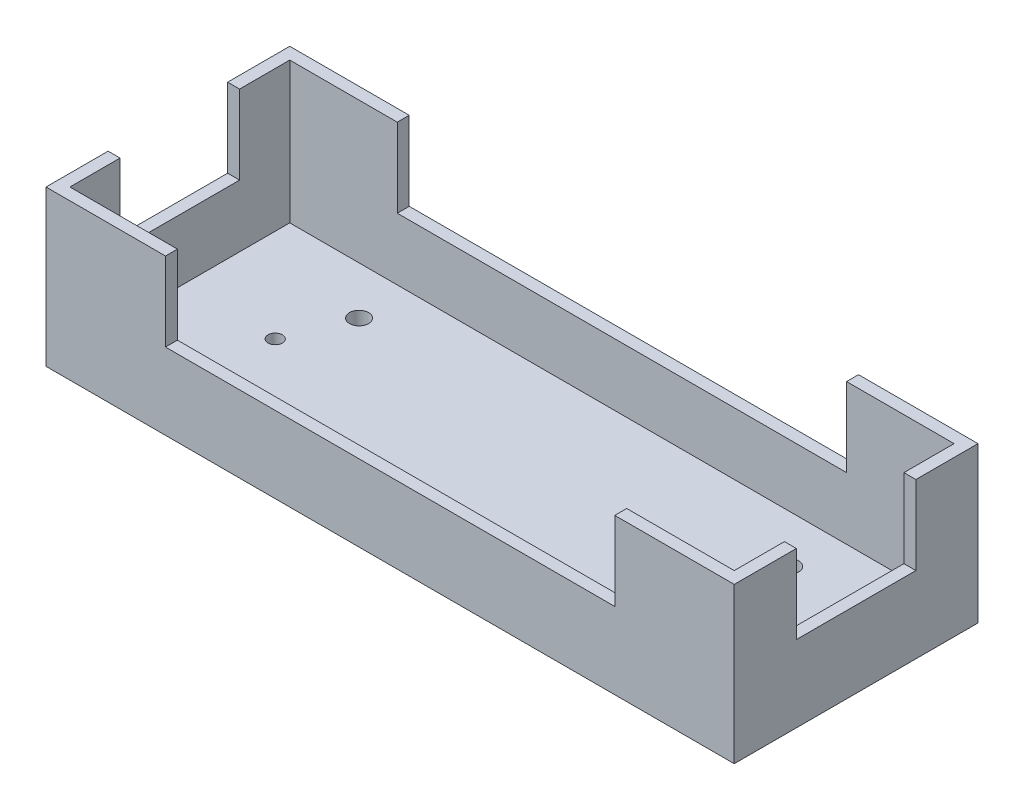
from build123d import *

# Parameters (mm, degrees)
SKETCH1_W           = 144
SKETCH1_H           = 51
BOSS_EXTRUDE1_DEPTH = 3
BOSS_EXTRUDE2_START = -3
SKETCH2_W           = 144
SKETCH2_H           = 51
SKETCH2_W_2         = 139
SKETCH2_H_2         = 46
BOSS_EXTRUDE2_DEPTH = 16
BOSS_EXTRUDE3_DEPTH = 16.5
SKETCH4_R           = 2
SKETCH4_R_2         = 1.5
CUT_EXTRUDE1_DEPTH  = 84.009035653


with BuildPart() as part:
    # Sketch1 → Boss-Extrude1 (new body)
    with BuildSketch(Plane(origin=(0, 0, 0), x_dir=(1, 0, 0), z_dir=(0, 1, 0))):
        Rectangle(SKETCH1_W, SKETCH1_H)
    extrude(amount=BOSS_EXTRUDE1_DEPTH)

    # Sketch2 → Boss-Extrude2 (add)
    with BuildSketch(Plane(origin=(0, 3, 0), x_dir=(1, 0, 0), z_dir=(0, 1, 0)).offset(BOSS_EXTRUDE2_START)):
        Rectangle(SKETCH2_W, SKETCH2_H)
        Rectangle(SKETCH2_W_2, SKETCH2_H_2, mode=Mode.SUBTRACT)
    extrude(amount=BOSS_EXTRUDE2_DEPTH)

    # Sketch3 → Boss-Extrude3 (add)
    with BuildSketch(Plane(origin=(0, 16, 0), x_dir=(1, 0, 0), z_dir=(0, 1, 0))):
        Polygon((-72, 25.5), (-72, 12.5), (-69.5, 12.5), (-69.5, 23), (-47, 23), (-47, 25.5), align=None)
        Polygon((47, 25.5), (72, 25.5), (72, 12.5), (69.5, 12.5), (69.5, 23), (47, 23), align=None)
        Polygon((72, -25.5), (72, -12.5), (69.5, -12.5), (69.5, -23), (47, -23), (47, -25.5), align=None)
        Polygon((-47, -25.5), (-72, -25.5), (-72, -12.5), (-69.5, -12.5), (-69.5, -23), (-47, -23), align=None)
    extrude(amount=BOSS_EXTRUDE3_DEPTH)

    # Sketch4 → Cut-Extrude1 (cut, through all)
    with BuildSketch(Plane.XZ):
        with Locations(Location((-45, -13, 0), (0, 0, 270))):
            Circle(SKETCH4_R)
        with Locations(Location((-45, 13, 0), (0, 0, 270))):
            Circle(SKETCH4_R)
        with Locations(Location((45, 13, 0), (0, 0, 270))):
            Circle(SKETCH4_R)
        with Locations(Location((45, -13, 0), (0, 0, 270))):
            Circle(SKETCH4_R)
        with Locations(Location((-50, -0.45, 0), (0, 0, 270))):
            Circle(SKETCH4_R_2)
        with Locations(Location((50, -0.45, 0), (0, 0, 270))):
            Circle(SKETCH4_R_2)
    extrude(amount=-CUT_EXTRUDE1_DEPTH, mode=Mode.SUBTRACT)


solid = part.part
